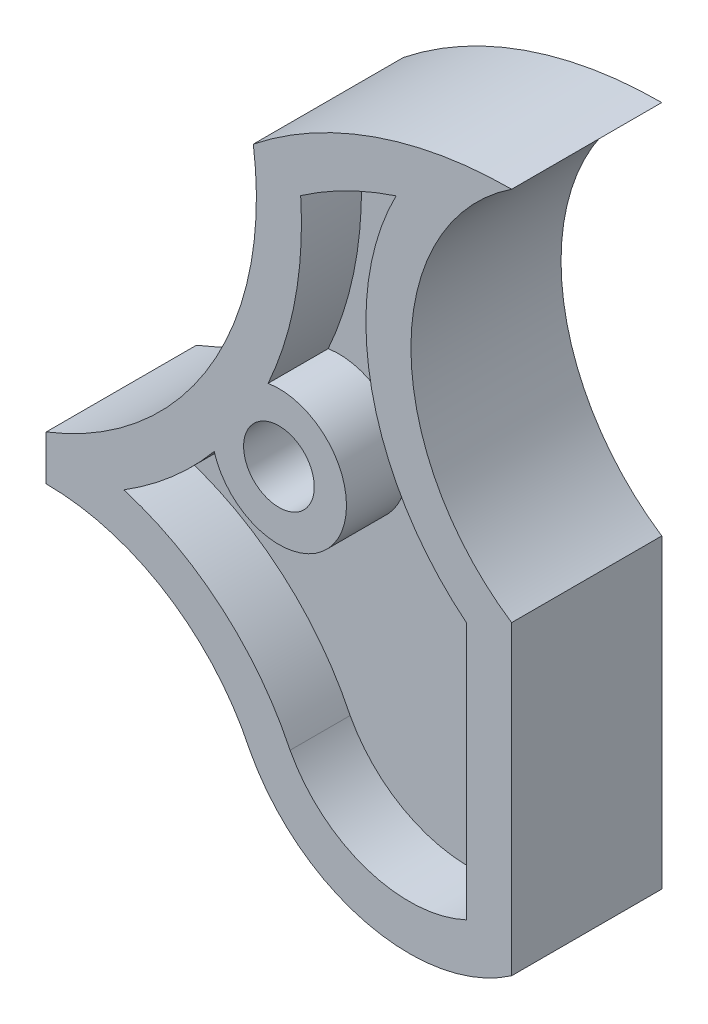
from build123d import *

# Parameters (mm, degrees)
CROQUIS1_W              = 31
CROQUIS1_H              = 47.5
CROQUIS1_R              = 1.5
SALIENTE_EXTRUIR1_DEPTH = 5
CORTAR_EXTRUIR1_DEPTH   = 10
CORTAR_EXTRUIR2_START   = -4
CROQUIS4_R              = 1.5
CORTAR_EXTRUIR2_DEPTH   = 4
SALIENTE_EXTRUIR2_START = -6
CROQUIS5_R              = 2.355
SALIENTE_EXTRUIR2_DEPTH = 10


with BuildPart() as part:
    # Croquis1 → Saliente-Extruir1 (new, symmetric)
    with BuildSketch(Plane.XY):
        Rectangle(CROQUIS1_W, CROQUIS1_H)
        Circle(CROQUIS1_R, mode=Mode.SUBTRACT)
    extrude(amount=SALIENTE_EXTRUIR1_DEPTH, both=True)

    # Croquis2 → Cortar-Extruir1 (cut)
    with BuildSketch(Plane.XY.offset(5)):
        with BuildLine():
            ThreePointArc((-15.5, -8.75), (-26.106601718, -34.356601718), (-0.5, -23.75))
            Line((-0.5, -23.75), (-15.5, -23.75))
            Line((-15.5, -23.75), (-15.5, -8.75))
        make_face()
        with BuildLine():
            Line((-15.5, -23.75), (-0.5, -23.75))
            ThreePointArc((-0.5, -23.75), (-0.864332185, -20.464086488), (-1.939630348, -17.337794848))
            ThreePointArc((-1.939630348, -17.337794848), (-7.474511768, -11.077528314), (-15.5, -8.75))
            Line((-15.5, -8.75), (-15.5, -23.75))
        make_face()
        with BuildLine():
            Line((-0.5, -23.75), (8.68, -23.75))
            ThreePointArc((8.68, -23.75), (2.477320667, -22.022622308), (-1.939630348, -17.337794848))
            ThreePointArc((-1.939630348, -17.337794848), (-0.864332185, -20.464086488), (-0.5, -23.75))
        make_face()
        with BuildLine():
            Line((8.68, -23.75), (15.5, -23.75))
            Line((15.5, -23.75), (15.5, -21.623580911))
            ThreePointArc((15.5, -21.623580911), (12.251906289, -23.206067627), (8.68, -23.75))
        make_face()
        with BuildLine():
            ThreePointArc((-1.706345602, 17.75), (6.388766151, 22.206978995), (15.5, 23.75))
            Line((15.5, 23.75), (-15.5, 23.75))
            Line((-15.5, 23.75), (-15.5, -5.75))
            ThreePointArc((-15.5, -5.75), (-4.526914837, 3.607383252), (-1.706345602, 17.75))
        make_face()
        with BuildLine():
            ThreePointArc((15.5, 23.75), (8.791561976, 11.25), (15.5, -1.25))
            Line((15.5, -1.25), (15.5, 23.75))
        make_face()
    extrude(amount=-CORTAR_EXTRUIR1_DEPTH, mode=Mode.SUBTRACT)

    # Croquis4 → Cortar-Extruir2 (cut)
    with BuildSketch(Plane.XY.offset(5).offset(CORTAR_EXTRUIR2_START)):
        with BuildLine():
            ThreePointArc((0.741753077, -15.99078245), (-3.792394766, -10.077692964), (-10.332847598, -6.50759483))
            ThreePointArc((-10.332847598, -6.50759483), (-1.276413132, 3.29347854), (1.447897595, 16.357098845))
            ThreePointArc((1.447897595, 16.357098845), (4.511231243, 18.167637942), (7.803157135, 19.518670428))
            ThreePointArc((7.803157135, 19.518670428), (6.178453275, 7.53807302), (12.5, -2.767868174))
            Line((12.5, -2.767868174), (12.5, -19.899085838))
            ThreePointArc((12.5, -19.899085838), (5.841215353, -20.290567998), (0.741753077, -15.99078245))
        make_face()
        Circle(CROQUIS4_R, mode=Mode.SUBTRACT)
    cortar_extruir2 = extrude(amount=CORTAR_EXTRUIR2_DEPTH, mode=Mode.SUBTRACT)

    # Simetría1: Cortar-Extruir2 across plane
    add(cortar_extruir2.mirror(Plane.XY), mode=Mode.SUBTRACT)

    # Croquis5 → Saliente-Extruir2 (add)
    with BuildSketch(Plane.XY.offset(1).offset(SALIENTE_EXTRUIR2_START)):
        with BuildLine():
            ThreePointArc((-4.313183402, -1.283140267), (0.648334286, -4.453050938), (4.5, 0))
            ThreePointArc((4.5, 0), (2.91581216, 3.427541312), (-0.721350866, 4.441807394))
            ThreePointArc((-0.721350866, 4.441807394), (-2.322917222, 1.457398417), (-4.313183402, -1.283140267))
        make_face()
        with Locations(Location((0, 0, 0), (0, 0, 180))):
            Circle(CROQUIS5_R, mode=Mode.SUBTRACT)
    extrude(amount=SALIENTE_EXTRUIR2_DEPTH)


solid = part.part
